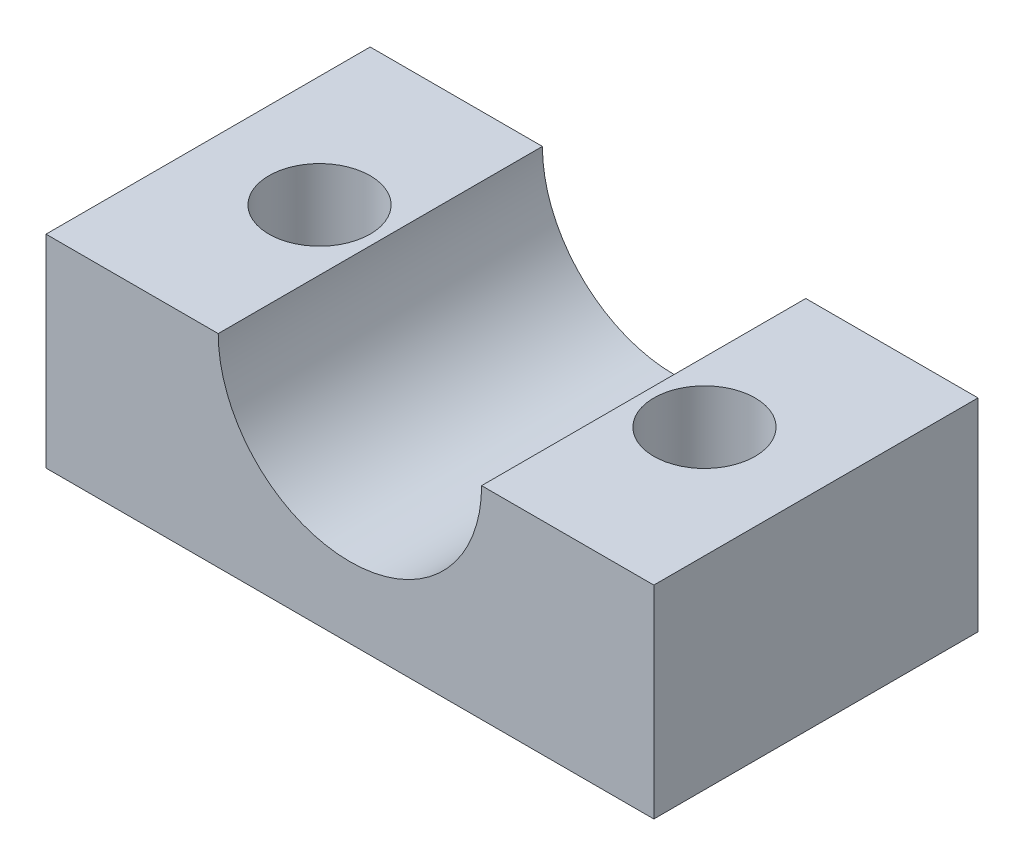
from build123d import *

# Parameters (mm, degrees)
BOSS_EXTRUDE1_DEPTH = 32
SKETCH2_R           = 5
CUT_EXTRUDE1_DEPTH  = 32


with BuildPart() as part:
    # Sketch1 → Boss-Extrude1 (new body)
    with BuildSketch(Plane.XY):
        with BuildLine():
            Line((-30, 0), (-13, 0))
            ThreePointArc((-13, 0), (0, -13), (13, 0))
            Line((13, 0), (30, 0))
            Line((30, 0), (30, -20))
            Line((30, -20), (-30, -20))
            Line((-30, -20), (-30, 0))
        make_face()
    extrude(amount=BOSS_EXTRUDE1_DEPTH)

    # Sketch2 → Cut-Extrude1 (cut)
    with BuildSketch(Plane.XZ.offset(20)):
        with Locations(Location((-19, 16, 0), (0, 0, 270))):
            Circle(SKETCH2_R)
        with Locations(Location((19, 16, 0), (0, 0, 270))):
            Circle(SKETCH2_R)
    extrude(amount=-CUT_EXTRUDE1_DEPTH, mode=Mode.SUBTRACT)


solid = part.part
